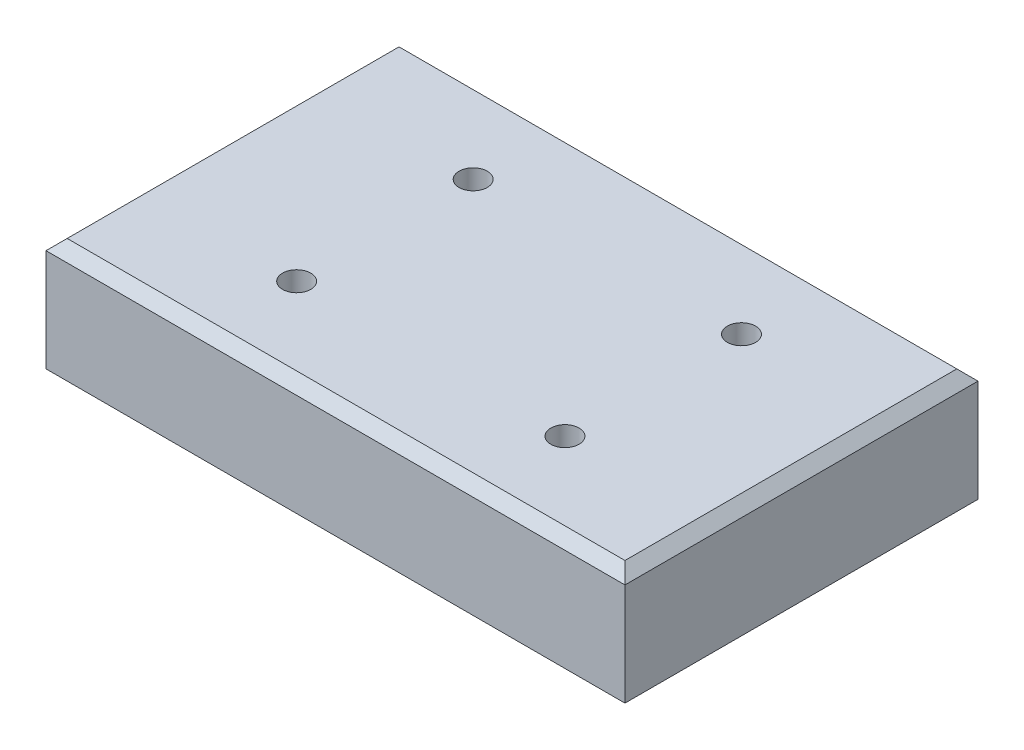
from build123d import *

# Parameters (mm, degrees)
SKETCH1_W                               = 82
SKETCH1_H                               = 50
BOSS_EXTRUDE1_DEPTH                     = 8
CHAMFER1_SIZE                           = 1.5
CBORE_FOR_M5_HEX_HEAD_BOLT1_D           = 3
CBORE_FOR_M5_HEX_HEAD_BOLT1_DEPTH       = 8
CBORE_FOR_M5_HEX_HEAD_BOLT1_CBORE_D     = 4
CBORE_FOR_M5_HEX_HEAD_BOLT1_CBORE_DEPTH = 6
CBORE_FOR_M5_HEX_HEAD_BOLT1_TIP         = 0.901290929


with BuildPart() as part:
    # Sketch1 → Boss-Extrude1 (new, symmetric)
    with BuildSketch(Plane(origin=(0, 0, 0), x_dir=(1, 0, 0), z_dir=(0, 1, 0))):
        Rectangle(SKETCH1_W, SKETCH1_H)
    extrude(amount=BOSS_EXTRUDE1_DEPTH, both=True)

    # Chamfer1
    chamfer1_edges = [part.edges().sort_by_distance(p)[0] for p in [
        (41, 8, 0),
        (0, 8, -25),
        (-41, 8, 0),
        (0, 8, 25),
    ]]
    chamfer(chamfer1_edges, length=CHAMFER1_SIZE)

    # CBORE for M5 Hex Head Bolt1
    with Locations(Plane(origin=(0, 8, 0), x_dir=(1, 0, 0), z_dir=(0, 1, 0))):
        with Locations((-18, 12.5), (-18, -12.5), (20, -12.5), (20, 12.5)):
            CounterBoreHole(CBORE_FOR_M5_HEX_HEAD_BOLT1_D / 2, CBORE_FOR_M5_HEX_HEAD_BOLT1_CBORE_D / 2, CBORE_FOR_M5_HEX_HEAD_BOLT1_CBORE_DEPTH, depth=CBORE_FOR_M5_HEX_HEAD_BOLT1_DEPTH)
            with Locations((0, 0, -(CBORE_FOR_M5_HEX_HEAD_BOLT1_DEPTH + CBORE_FOR_M5_HEX_HEAD_BOLT1_TIP / 2))):  # 118° drill point
                Cone(0, CBORE_FOR_M5_HEX_HEAD_BOLT1_D / 2, CBORE_FOR_M5_HEX_HEAD_BOLT1_TIP, mode=Mode.SUBTRACT)


solid = part.part
